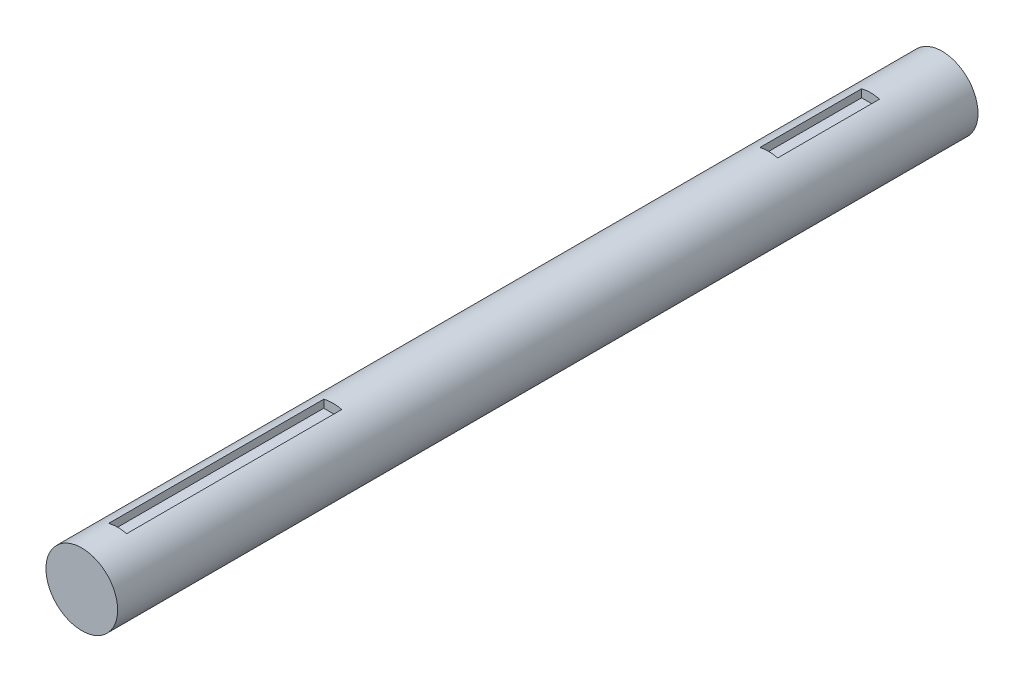
from build123d import *

# Parameters (mm, degrees)
SKETCH1_R           = 6.35
BOSS_EXTRUDE1_DEPTH = 152.4
CUT_EXTRUDE1_DEPTH  = 18.034
CUT_EXTRUDE2_DEPTH  = 38.1


with BuildPart() as part:
    # Sketch1 → Boss-Extrude1 (new body)
    with BuildSketch(Plane.XY):
        with Locations(Location((0, 0, 0), (0, 0, 180))):
            Circle(SKETCH1_R)
    extrude(amount=BOSS_EXTRUDE1_DEPTH)

    # Sketch2 → Cut-Extrude1 (cut)
    with BuildSketch(Plane(origin=(0, 0, 12.7), x_dir=(-1, 0, 0), z_dir=(0, 0, -1))):
        Polygon((1.571433325, 4.7625), (-0.016066675, 4.7625), (-1.603566675, 4.7625), (-1.603566675, 7.9375), (1.571433325, 7.9375), align=None)
    extrude(amount=-CUT_EXTRUDE1_DEPTH, mode=Mode.SUBTRACT)

    # Sketch3 → Cut-Extrude2 (cut)
    with BuildSketch(Plane.XY.offset(146.05)):
        Polygon((0, 4.7625), (1.5875, 4.7625), (1.5875, 7.9375), (-1.5875, 7.9375), (-1.5875, 4.7625), align=None)
    extrude(amount=-CUT_EXTRUDE2_DEPTH, mode=Mode.SUBTRACT)


solid = part.part
